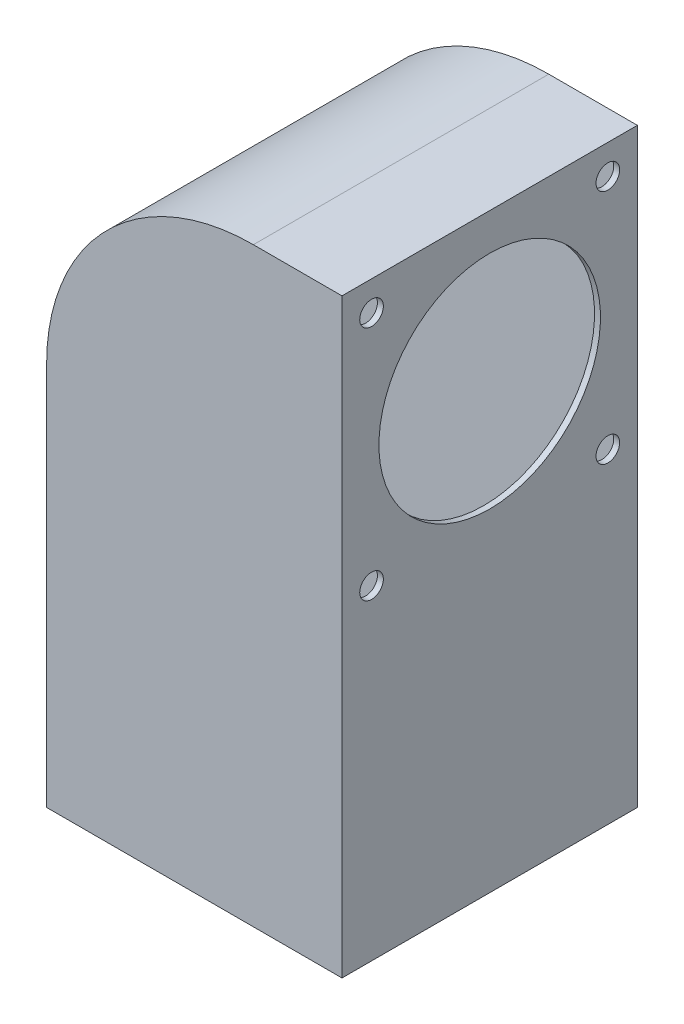
from build123d import *

# Parameters (mm, degrees)
SUPERFICIE_EXTRUIR1_2_DEPTH = 100
DAR_ESPESOR1_T2             = 2
CROQUIS4_R                  = 37.5
CROQUIS4_R_2                = 4
EXTRUIR3_DEPTH              = 11


with BuildPart() as body_1:
    # Superficie-Extruir1: a surface, the sketch's curves swept straight by 100 mm
    with BuildLine(Plane.XY, mode=Mode.PRIVATE) as superficie_extruir1_2_path:
        Line((-100, -200), (-100, -70))
        ThreePointArc((-100, -70), (-79.497474683, -20.502525317), (-30, 0))
        Line((-30, 0), (0, 0))
        Line((0, 0), (0, -200))
    superficie_extruir1_2 = Shell.extrude(superficie_extruir1_2_path.wire(), (0 * SUPERFICIE_EXTRUIR1_2_DEPTH, 0 * SUPERFICIE_EXTRUIR1_2_DEPTH, 1 * SUPERFICIE_EXTRUIR1_2_DEPTH))
    # Croquis5 → Superficie-Plano1: a flat surface bounded by the sketch
    with BuildSketch(Plane(origin=(0, 0, 100), x_dir=(-1, 0, 0), z_dir=(0, 0, -1)), mode=Mode.PRIVATE) as superficie_plano1_3_region:
        with BuildLine():
            Line((100, -200), (0, -200))
            Line((0, -200), (0, 0))
            Line((0, 0), (30, 0))
            ThreePointArc((30, 0), (79.497474683, -20.502525317), (100, -70))
            Line((100, -70), (100, -200))
        make_face()
    superficie_plano1_3 = superficie_plano1_3_region.sketch.faces()[0]
    # Croquis6 → Superficie-Plano2: a flat surface bounded by the sketch
    with BuildSketch(Plane(origin=(0, 0, 0), x_dir=(-1, 0, 0), z_dir=(0, 0, -1)), mode=Mode.PRIVATE) as superficie_plano2_4_region:
        with BuildLine():
            Line((0, -200), (100, -200))
            Line((100, -200), (100, -70))
            ThreePointArc((100, -70), (79.497474683, -20.502525317), (30, 0))
            Line((30, 0), (0, 0))
            Line((0, 0), (0, -200))
        make_face()
    superficie_plano2_4 = superficie_plano2_4_region.sketch.faces()[0]
    # Superficie-Coser1: the surfaces knitted into one
    superficie_coser1_1 = Shell(Face.sew_faces(superficie_extruir1_2.faces() + superficie_plano1_3.faces() + superficie_plano2_4.faces())[0])
    add(Solid.thicken(superficie_coser1_1, -DAR_ESPESOR1_T2))

    # Croquis4 → Extruir3 (cut)
    with BuildSketch(Plane(origin=(0, 0, 0), x_dir=(0, 0, -1), z_dir=(1, 0, 0))):
        with Locations(Location((-50, -50, 0), (0, 0, 90))):
            Circle(CROQUIS4_R)
        with Locations(Location((-90, -10, 0), (0, 0, 90))):
            Circle(CROQUIS4_R_2)
        with Locations(Location((-10, -10, 0), (0, 0, 90))):
            Circle(CROQUIS4_R_2)
        with Locations(Location((-10, -90, 0), (0, 0, 90))):
            Circle(CROQUIS4_R_2)
        with Locations(Location((-90, -90, 0), (0, 0, 90))):
            Circle(CROQUIS4_R_2)
    extrude(amount=-EXTRUIR3_DEPTH, mode=Mode.SUBTRACT)


solid = body_1.part
